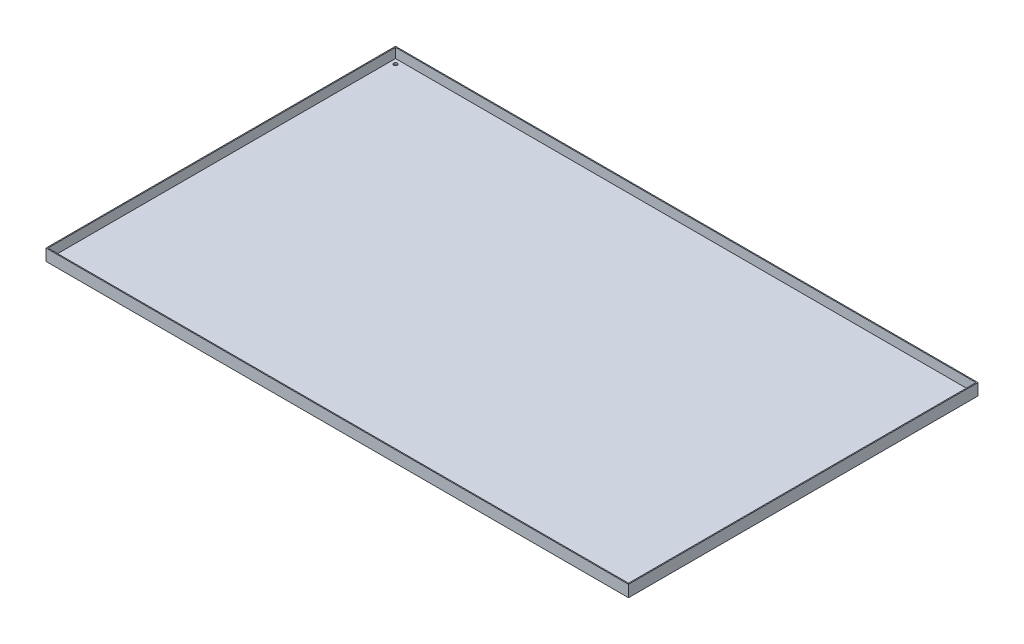
from build123d import *

# Parameters (mm, degrees)
SKETCH1_W           = 3000
SKETCH1_H           = 1800
BOSS_EXTRUDE2_DEPTH = 60
SKETCH2_W           = 2990
SKETCH2_H           = 1790
CUT_EXTRUDE1_DEPTH  = 50
SKETCH3_R           = 10
CUT_EXTRUDE2_DEPTH  = 10


with BuildPart() as part:
    # Sketch1 → Boss-Extrude2 (new body)
    with BuildSketch(Plane(origin=(0, 0, 0), x_dir=(1, 0, 0), z_dir=(0, 1, 0))):
        with Locations((1500, 900)):
            Rectangle(SKETCH1_W, SKETCH1_H)
    extrude(amount=BOSS_EXTRUDE2_DEPTH)

    # Sketch2 → Cut-Extrude1 (cut)
    with BuildSketch(Plane(origin=(0, 60, 0), x_dir=(1, 0, 0), z_dir=(0, 1, 0))):
        with Locations((1500, 900)):
            Rectangle(SKETCH2_W, SKETCH2_H)
    extrude(amount=-CUT_EXTRUDE1_DEPTH, mode=Mode.SUBTRACT)

    # Sketch3 → Cut-Extrude2 (cut)
    with BuildSketch(Plane(origin=(0, 10, 0), x_dir=(1, 0, 0), z_dir=(0, 1, 0))):
        with Locations(Location((30, 1770, 0), (0, 0, 270))):
            Circle(SKETCH3_R)
        with Locations(Location((2970, 1770, 0), (0, 0, 90))):
            Circle(SKETCH3_R)
        with Locations(Location((30, 30, 0), (0, 0, 90))):
            Circle(SKETCH3_R)
        with Locations(Location((2970, 30, 0), (0, 0, 270))):
            Circle(SKETCH3_R)
    extrude(amount=-CUT_EXTRUDE2_DEPTH, mode=Mode.SUBTRACT)


solid = part.part
